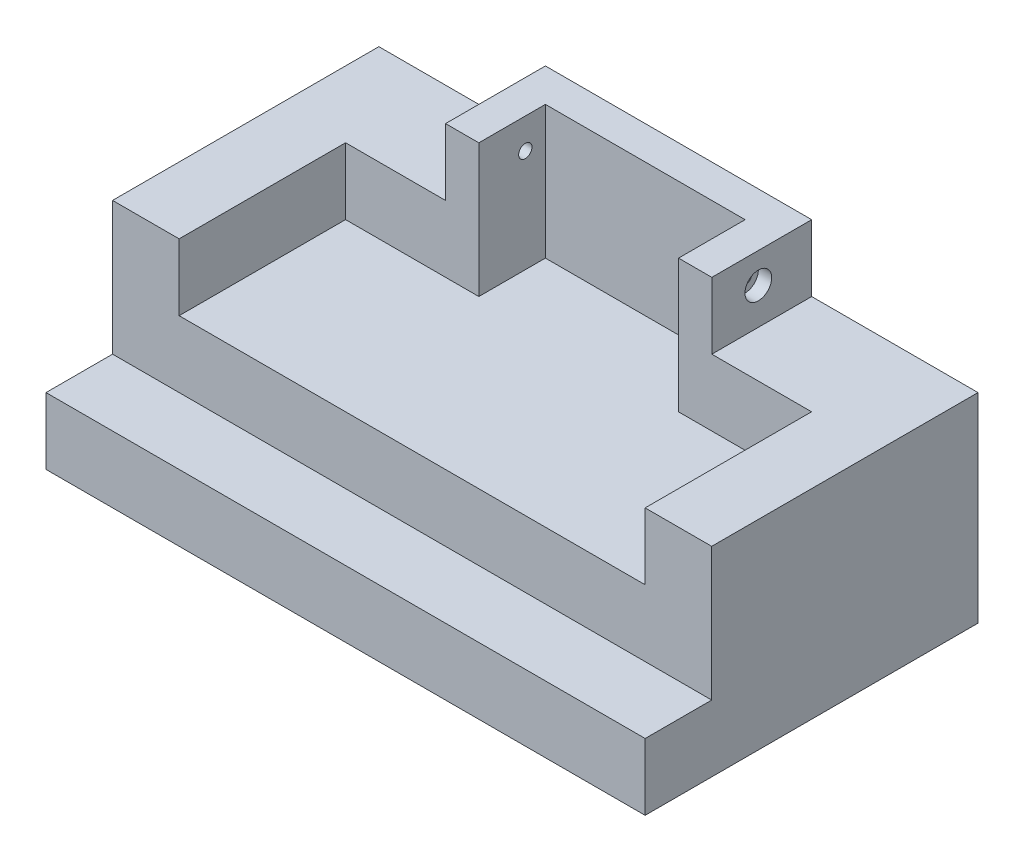
from build123d import *

# Parameters (mm, degrees)
SKETCH2_W                                        = 4.5
SKETCH2_H                                        = 2.5
BOSS_EXTRUDE1_DEPTH                              = 2
CUT_EXTRUDE3_DEPTH                               = 0.5
CUT_EXTRUDE5_DEPTH                               = 0.5
CUT_EXTRUDE6_DEPTH                               = 1
CBORE_FOR_M2_HEX_HEAD_MACHINE_SCREW1_D           = 0.1
CBORE_FOR_M2_HEX_HEAD_MACHINE_SCREW1_DEPTH       = 2
CBORE_FOR_M2_HEX_HEAD_MACHINE_SCREW1_CBORE_D     = 0.2
CBORE_FOR_M2_HEX_HEAD_MACHINE_SCREW1_CBORE_DEPTH = 0.1
CBORE_FOR_M2_HEX_HEAD_MACHINE_SCREW1_TIP         = 0.030043031


with BuildPart() as part:
    # Sketch2 → Boss-Extrude1 (new body)
    with BuildSketch(Plane(origin=(0, 0, 0), x_dir=(1, 0, 0), z_dir=(0, 1, 0))):
        with Locations((2.25, 1.25)):
            Rectangle(SKETCH2_W, SKETCH2_H)
    extrude(amount=BOSS_EXTRUDE1_DEPTH)

    # Sketch6 → Cut-Extrude3 (cut)
    with BuildSketch(Plane(origin=(0, 2, 0), x_dir=(1, 0, 0), z_dir=(0, 1, 0))):
        Polygon((3.000874861, 2.25), (1.500874861, 2.25), (1.500874861, 1.75), (1.250874861, 1.75), (1.250874861, 2.5), (0, 2.5), (0, 0), (4.5, 0), (4.5, 2.5), (3.250874861, 2.5), (3.250874861, 1.75), (3.000874861, 1.75), align=None)
    extrude(amount=-CUT_EXTRUDE3_DEPTH, mode=Mode.SUBTRACT)

    # Sketch9 → Cut-Extrude5 (cut)
    with BuildSketch(Plane(origin=(0, 1.5, 0), x_dir=(1, 0, 0), z_dir=(0, 1, 0))):
        Polygon((0.5, 1.75), (0.5, 0.499892289), (4, 0.499892289), (4, 1.75), (3.000874861, 1.75), (3.000874861, 2.25), (1.500874861, 2.25), (1.500874861, 1.75), align=None)
    extrude(amount=-CUT_EXTRUDE5_DEPTH, mode=Mode.SUBTRACT)

    # Sketch10 → Cut-Extrude6 (cut)
    with BuildSketch(Plane(origin=(0, 1.5, 0), x_dir=(1, 0, 0), z_dir=(0, 1, 0))):
        Polygon((0.5, 0.499892289), (0, 0.499892289), (0, 0), (4.5, 0), (4.5, 0.499892289), align=None)
    extrude(amount=-CUT_EXTRUDE6_DEPTH, mode=Mode.SUBTRACT)

    # CBORE for M2 Hex Head Machine Screw1
    with Locations(Plane(origin=(3.250874861, 0, 0), x_dir=(0, 0, -1), z_dir=(1, 0, 0))):
        with Locations((2.099262102, 1.772792527)):
            CounterBoreHole(CBORE_FOR_M2_HEX_HEAD_MACHINE_SCREW1_D / 2, CBORE_FOR_M2_HEX_HEAD_MACHINE_SCREW1_CBORE_D / 2, CBORE_FOR_M2_HEX_HEAD_MACHINE_SCREW1_CBORE_DEPTH, depth=CBORE_FOR_M2_HEX_HEAD_MACHINE_SCREW1_DEPTH)
            with Locations((0, 0, -(CBORE_FOR_M2_HEX_HEAD_MACHINE_SCREW1_DEPTH + CBORE_FOR_M2_HEX_HEAD_MACHINE_SCREW1_TIP / 2))):  # 118° drill point
                Cone(0, CBORE_FOR_M2_HEX_HEAD_MACHINE_SCREW1_D / 2, CBORE_FOR_M2_HEX_HEAD_MACHINE_SCREW1_TIP, mode=Mode.SUBTRACT)


solid = part.part
